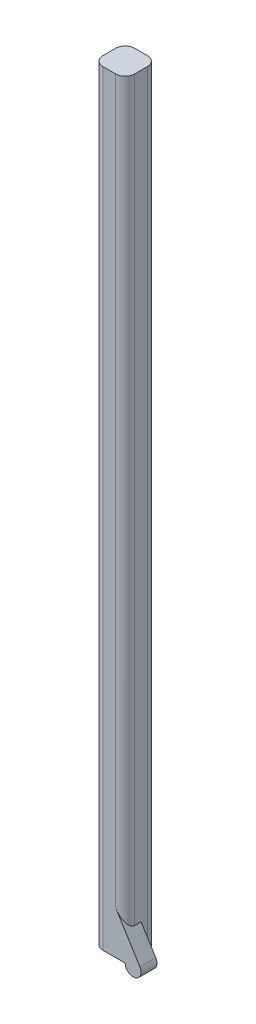
from build123d import *

# Parameters (mm, degrees)
SKETCH3_W           = 10
SKETCH3_H           = 10
BOSS_EXTRUDE3_DEPTH = 241
BOSS_EXTRUDE4_DEPTH = 5
FILLET1_R           = 3


with BuildPart() as part:
    # Sketch3 → Boss-Extrude3 (new body)
    with BuildSketch(Plane(origin=(0, 0, 0), x_dir=(1, 0, 0), z_dir=(0, 1, 0))):
        Rectangle(SKETCH3_W, SKETCH3_H)
    extrude(amount=BOSS_EXTRUDE3_DEPTH)

    # Sketch4 → Boss-Extrude4 (add)
    with BuildSketch(Plane.XY.offset(5)):
        with BuildLine():
            Line((5, 8.767157353), (5, 0))
            ThreePointArc((5, 0), (8.185559909, -2.404164639), (9.624006089, 1.318559113))
            Line((9.624006089, 1.318559113), (5, 8.767157353))
        make_face()
    extrude(amount=-BOSS_EXTRUDE4_DEPTH)

    # Fillet1
    fillet1_edges = [part.edges().sort_by_distance(p)[0] for p in [
        (-5, 120.5, -5),
        (5, 120.5, -5),
        (5, 124.883578677, 5),
        (-5, 120.5, 5),
    ]]
    fillet(fillet1_edges, radius=FILLET1_R)


solid = part.part
